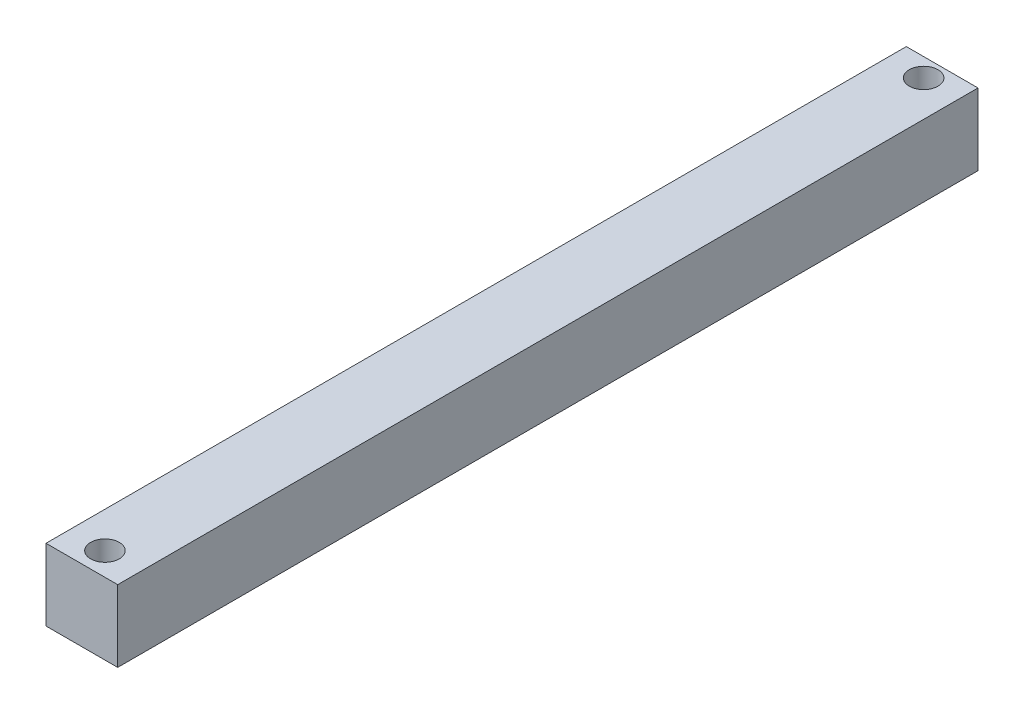
from build123d import *

# Parameters (mm, degrees)
SKETCH_1_W          = 30
SKETCH_1_H          = 30
EXTRUDE_1_DEPTH     = 360
SKETCH_2_R          = 6
CUT_EXTRUDE_1_DEPTH = 360


with BuildPart() as part:
    # 스케치1 → 보스-돌출1 (new body)
    with BuildSketch(Plane.XY):
        with Locations((0.870112419, -4.331896552)):
            Rectangle(SKETCH_1_W, SKETCH_1_H)
    extrude(amount=EXTRUDE_1_DEPTH)

    # 스케치2 → 컷-돌출1 (cut)
    with BuildSketch(Plane(origin=(0, 10.668103448, 0), x_dir=(1, 0, 0), z_dir=(0, 1, 0))):
        with Locations(Location((0.870112419, -7.748652883, 0), (0, 0, 270))):
            Circle(SKETCH_2_R)
        with Locations(Location((0.870112419, -350.334781364, 0), (0, 0, 270))):
            Circle(SKETCH_2_R)
    extrude(amount=-CUT_EXTRUDE_1_DEPTH, mode=Mode.SUBTRACT)


solid = part.part
